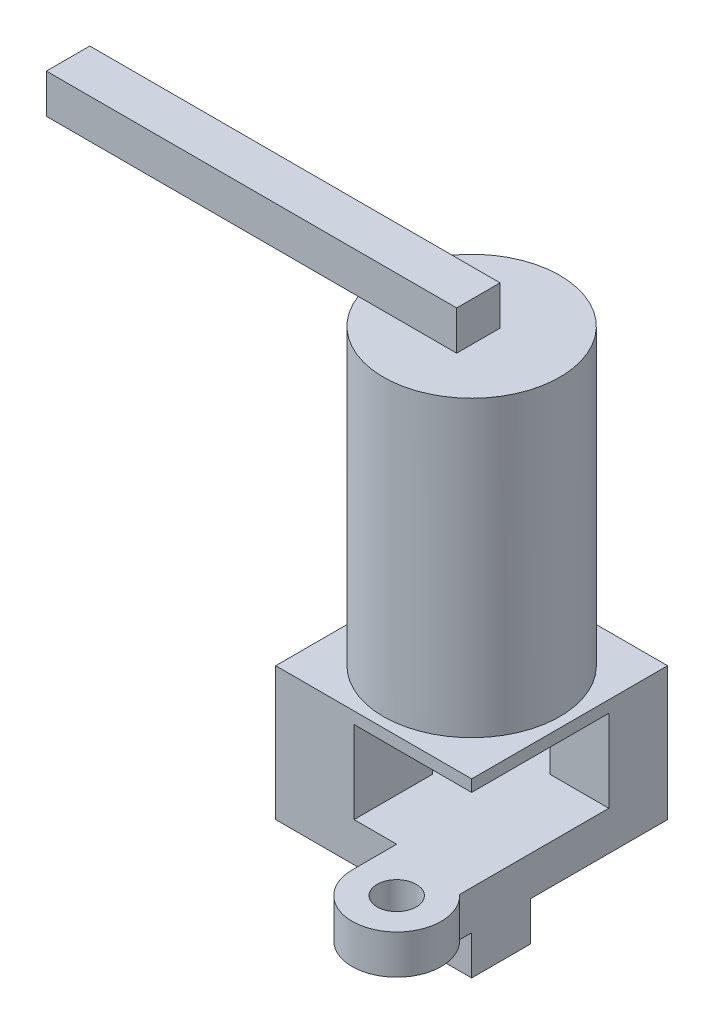
from build123d import *

# Parameters (mm, degrees)
SKETCH1_R           = 5
BOSS_EXTRUDE1_DEPTH = 10
BOSS_EXTRUDE2_DEPTH = 10
SKETCH3_W           = 20
SKETCH3_H           = 20
SKETCH3_W_2         = 15
SKETCH3_H_2         = 15
BOSS_EXTRUDE3_DEPTH = 21
SKETCH4_W           = 50
SKETCH4_H           = 50
BOSS_EXTRUDE4_DEPTH = 3
SKETCH5_R           = 22.5
BOSS_EXTRUDE5_DEPTH = 75
SKETCH6_W           = 104.673759345
SKETCH6_H           = 11.076222709
BOSS_EXTRUDE6_DEPTH = 10


with BuildPart() as part:
    # Sketch1 → Boss-Extrude1 (new body)
    with BuildSketch(Plane(origin=(0, 0, 0), x_dir=(1, 0, 0), z_dir=(0, 1, 0))):
        with BuildLine():
            Line((0, 0), (30.876052193, 0))
            Line((30.876052193, 0), (30.876052193, -11.362717468))
            ThreePointArc((30.876052193, -11.362717468), (46.762190972, -21.786248919), (50, -3.063642105))
            Line((50, -3.063642105), (50, 0))
            Line((50, 0), (50, 50))
            Line((50, 50), (0, 50))
            Line((0, 50), (0, 0))
        make_face()
        with Locations(Location((42.238769661, -11.362717468, 0), (0, 0, 270))):
            Circle(SKETCH1_R, mode=Mode.SUBTRACT)
        with BuildLine():
            Line((9.874654059, 47.191553979), (24.296746366, 33.290272916))
            ThreePointArc((24.296746366, 33.290272916), (24.424993645, 26.799159409), (17.934255558, 26.653142217))
            Line((17.934255558, 26.653142217), (3.436266044, 40.475249935))
            ThreePointArc((3.436266044, 40.475249935), (3.288101967, 47.061421086), (9.874654059, 47.191553979))
        make_face(mode=Mode.SUBTRACT)
    extrude(amount=BOSS_EXTRUDE1_DEPTH)

    # Sketch2 → Boss-Extrude2 (add)
    with BuildSketch(Plane.XZ):
        Polygon((45, -5), (35, -5), (35, 0), (50, 0), (50, -15), (45, -15), align=None)
    extrude(amount=BOSS_EXTRUDE2_DEPTH)

    # Sketch3 → Boss-Extrude3 (add)
    with BuildSketch(Plane(origin=(0, 10, 0), x_dir=(1, 0, 0), z_dir=(0, 1, 0))):
        with Locations((10, 10)):
            Rectangle(SKETCH3_W, SKETCH3_H)
        with Locations((42.5, 42.5)):
            Rectangle(SKETCH3_W_2, SKETCH3_H_2)
    extrude(amount=BOSS_EXTRUDE3_DEPTH)

    # Sketch4 → Boss-Extrude4 (add)
    with BuildSketch(Plane(origin=(0, 31, 0), x_dir=(1, 0, 0), z_dir=(0, 1, 0))):
        with Locations((25, 25)):
            Rectangle(SKETCH4_W, SKETCH4_H)
    extrude(amount=BOSS_EXTRUDE4_DEPTH)

    # Sketch5 → Boss-Extrude5 (add)
    with BuildSketch(Plane(origin=(0, 34, 0), x_dir=(1, 0, 0), z_dir=(0, 1, 0))):
        with Locations(Location((25, 25, 0), (0, 0, 270))):
            Circle(SKETCH5_R)
    extrude(amount=BOSS_EXTRUDE5_DEPTH)

    # Sketch6 → Boss-Extrude6 (add)
    with BuildSketch(Plane(origin=(0, 109, 0), x_dir=(1, 0, 0), z_dir=(0, 1, 0))):
        with Locations((-23.301664344, 22.675113634)):
            Rectangle(SKETCH6_W, SKETCH6_H)
    extrude(amount=BOSS_EXTRUDE6_DEPTH)


solid = part.part
